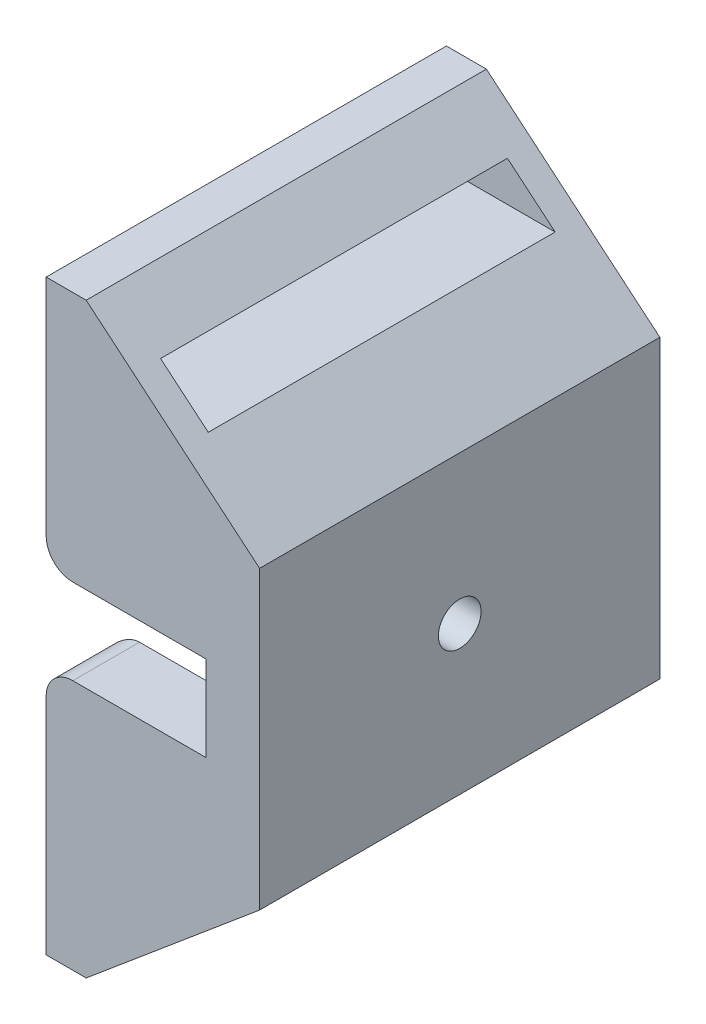
from build123d import *

# Parameters (mm, degrees)
SKETCH1_W               = 15
SKETCH1_H               = 22
BOSS_EXTRUDE1_DEPTH     = 8
SKETCH2_R               = 5.25
CUT_EXTRUDE1_DEPTH      = 6
CUT_EXTRUDE2_REACH      = 24.694
CUT_EXTRUDE2_END_RADIUS = 5.25
SKETCH3_W               = 6
SKETCH3_H               = 3.2
SKETCH4_W               = 13
SKETCH4_H               = 1.5
CUT_EXTRUDE3_DEPTH      = 10
SKETCH5_R               = 0.8
CUT_EXTRUDE4_DEPTH      = 20.544820286
CUT_EXTRUDE5_DEPTH      = 21.248456731
FILLET1_R               = 1


with BuildPart() as part:
    # Sketch1 → Boss-Extrude1 (new body)
    with BuildSketch(Plane(origin=(0, 0, -7.5), x_dir=(0, 0, 1), z_dir=(-1, 0, 0))):
        Rectangle(SKETCH1_W, SKETCH1_H)
    extrude(amount=BOSS_EXTRUDE1_DEPTH)

    # Sketch2 → Cut-Extrude1 (cut)
    with BuildSketch(Plane.ZY.offset(8)):
        with Locations((-7.5, 0)):
            Circle(SKETCH2_R)
    extrude(amount=-CUT_EXTRUDE1_DEPTH, mode=Mode.SUBTRACT)

    # Cut-Extrude2: up to this cylinder (the profile starts outside it)
    cut_extrude2_end = Plane(origin=(-5, 0, -7.5), z_dir=(-1, 0, 0)) * Cylinder(CUT_EXTRUDE2_END_RADIUS, 60.888, mode=Mode.PRIVATE)
    # Sketch3 → Cut-Extrude2 (cut, up to the surface)
    with BuildSketch(Plane(origin=(5, 0, 0), x_dir=(1, 0, 0), z_dir=(0, 0, 1)), mode=Mode.PRIVATE) as cut_extrude2_sk1:
        with Locations((-10, 0)):
            Rectangle(SKETCH3_W, SKETCH3_H)
    cut_extrude2_tool1 = extrude(cut_extrude2_sk1.sketch, amount=-CUT_EXTRUDE2_REACH, mode=Mode.PRIVATE) - cut_extrude2_end
    add(cut_extrude2_tool1.solids().sort_by_distance((-5, 0, 0))[0], mode=Mode.SUBTRACT)

    # Sketch4 → Cut-Extrude3 (cut)
    with BuildSketch(Plane(origin=(0, 0, 0), x_dir=(0, 0, -1), z_dir=(1, 0, 0))):
        with Locations((7.5, 8.75)):
            Rectangle(SKETCH4_W, SKETCH4_H)
        with Locations((7.5, -8.75)):
            Rectangle(SKETCH4_W, SKETCH4_H)
    extrude(amount=-CUT_EXTRUDE3_DEPTH, mode=Mode.SUBTRACT)

    # Sketch5 → Cut-Extrude4 (cut, through all)
    with BuildSketch(Plane.ZY.offset(2)):
        with Locations((-7.5, 0)):
            Circle(SKETCH5_R)
    extrude(amount=-CUT_EXTRUDE4_DEPTH, mode=Mode.SUBTRACT)

    # Sketch6 → Cut-Extrude5 (cut, through all)
    with BuildSketch(Plane.XY):
        Polygon((0, -11), (-6.5, -11), (0, -5.545852397), align=None)
        Polygon((0, 11), (-6.5, 11), (0, 5.545852397), align=None)
    extrude(amount=-CUT_EXTRUDE5_DEPTH, mode=Mode.SUBTRACT)

    # Fillet1
    fillet1_edges = [part.edges().sort_by_distance(p)[0] for p in [
        (-8, 0, -12.75),
        (-8, 1.6, -1.249875003),
        (-8, -1.6, -1.249875003),
    ]]
    fillet(fillet1_edges, radius=FILLET1_R)


solid = part.part
